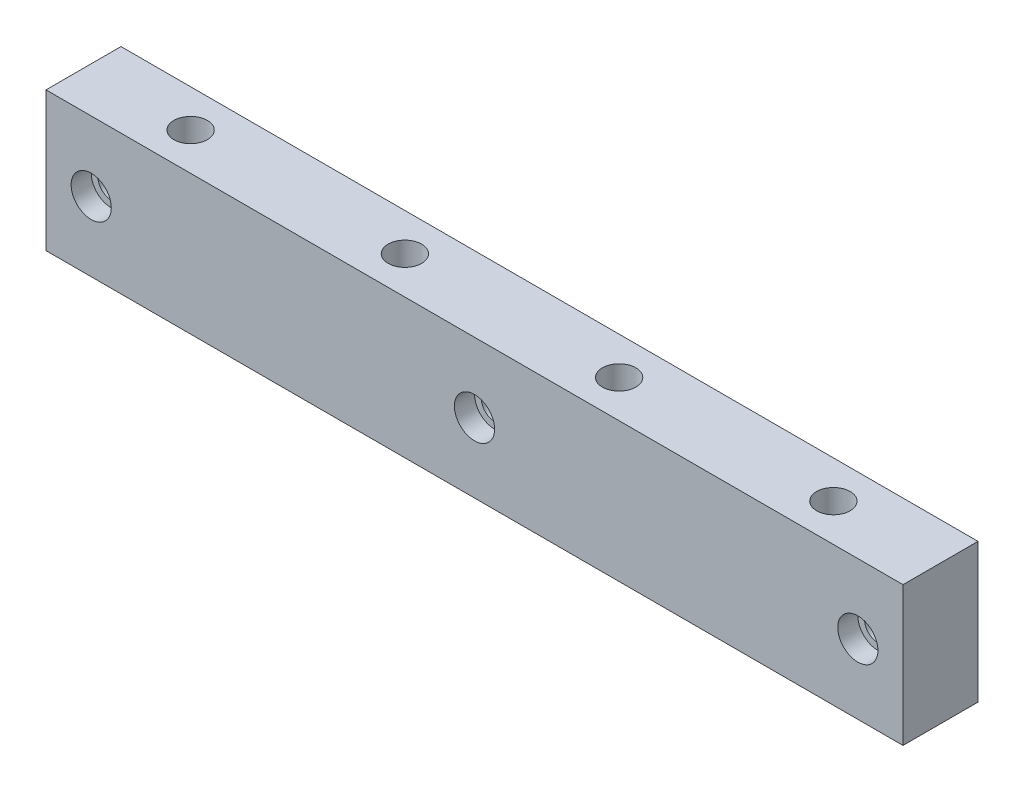
from build123d import *

# Parameters (mm, degrees)
SKETCH1_W           = 203.2
SKETCH1_H           = 17.78
SKETCH1_R           = 3.96875
BOSS_EXTRUDE1_DEPTH = 33.02
SKETCH2_R           = 3.175
CUT_EXTRUDE1_DEPTH  = 17.78
SKETCH3_R           = 4.7625
CUT_EXTRUDE2_DEPTH  = 4.7752


with BuildPart() as part:
    # Sketch1 → Boss-Extrude1 (new body)
    with BuildSketch(Plane(origin=(0, 0, 0), x_dir=(1, 0, 0), z_dir=(0, 1, 0))):
        with Locations((0, 8.89)):
            Rectangle(SKETCH1_W, SKETCH1_H)
        with Locations(Location((76.2, 8.89, 0), (0, 0, 270))):
            Circle(SKETCH1_R, mode=Mode.SUBTRACT)
        with Locations(Location((25.4, 8.89, 0), (0, 0, 270))):
            Circle(SKETCH1_R, mode=Mode.SUBTRACT)
        with Locations(Location((-25.4, 8.89, 0), (0, 0, 270))):
            Circle(SKETCH1_R, mode=Mode.SUBTRACT)
        with Locations(Location((-76.2, 8.89, 0), (0, 0, 270))):
            Circle(SKETCH1_R, mode=Mode.SUBTRACT)
    extrude(amount=-BOSS_EXTRUDE1_DEPTH)

    # Sketch2 → Cut-Extrude1 (cut)
    with BuildSketch(Plane.XY):
        with Locations((90.884375, -16.51)):
            Circle(SKETCH2_R)
        with Locations((0, -16.51)):
            Circle(SKETCH2_R)
        with Locations((-90.884375, -16.51)):
            Circle(SKETCH2_R)
    extrude(amount=-CUT_EXTRUDE1_DEPTH, mode=Mode.SUBTRACT)

    # Sketch3 → Cut-Extrude2 (cut)
    with BuildSketch(Plane.XY):
        with Locations((90.884375, -16.51)):
            Circle(SKETCH3_R)
        with Locations((0, -16.51)):
            Circle(SKETCH3_R)
        with Locations((-90.884375, -16.51)):
            Circle(SKETCH3_R)
    extrude(amount=-CUT_EXTRUDE2_DEPTH, mode=Mode.SUBTRACT)


solid = part.part
